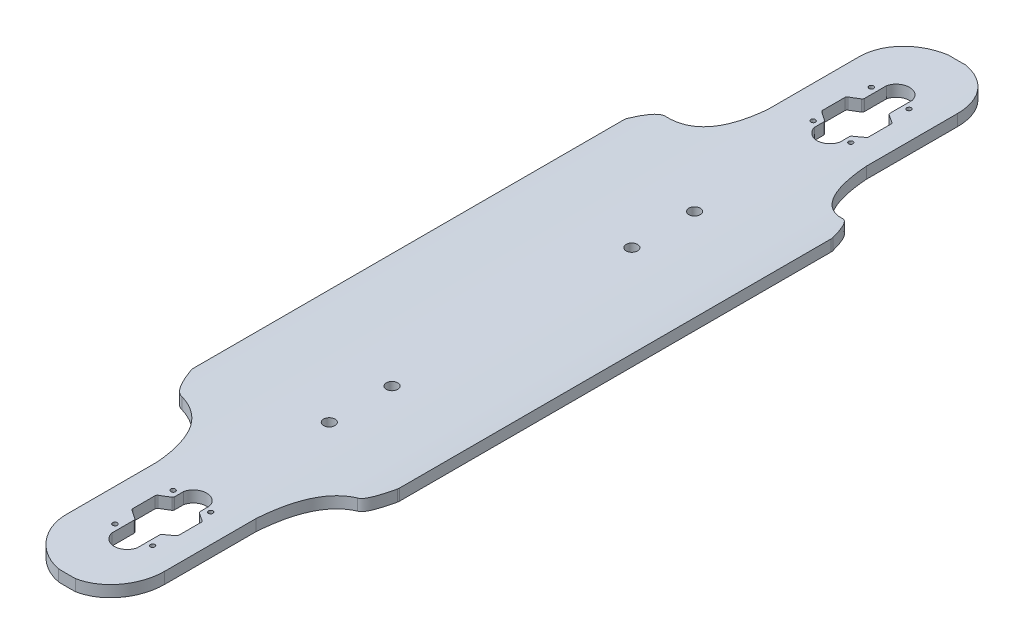
from build123d import *

# Parameters (mm, degrees)
BOSS_EXTRUDE1_DEPTH = 482.59999999999997
BOSS_EXTRUDE2_START = 98.425
BOSS_EXTRUDE2_DEPTH = 98.425
BOSS_EXTRUDE3_START = 254
BOSS_EXTRUDE3_DEPTH = 254
BOSS_EXTRUDE4_DEPTH = 254
BOSS_EXTRUDE5_DEPTH = 98.425
CUT_EXTRUDE1_DEPTH  = 98.425
SKETCH8_R           = 2.5399999999999943
SKETCH8_R_2         = 2.539999999999985
SKETCH8_R_3         = 2.5399999999999983
SKETCH8_R_4         = 2.539999999999981
SKETCH8_R_5         = 2.539999999999982
SKETCH8_R_6         = 2.539999999999969
CUT_EXTRUDE2_DEPTH  = 30.480000000000004
FILLET2_R           = 2.54
FILLET1_R           = 7.62
SKETCH9_R           = 6.349999999999994
SKETCH9_R_2         = 6.35000000000001
CUT_EXTRUDE3_DEPTH  = 38.1


with BuildPart() as part:
    # Sketch1 → Boss-Extrude1 (new body)
    with BuildSketch(Plane.XY):
        with BuildLine():
            ThreePointArc((230.18750000000014, -12.7), (115.09375000000016, -25.399999708217024), (1.3303e-13, -12.7))
            Line((1.3303e-13, -12.7), (0, 0))
            ThreePointArc((0, 0), (115.09375000000003, -12.699999708216978), (230.1875, 0))
            Line((230.1875, 0), (230.18750000000014, -12.7))
        make_face()
    extrude(amount=BOSS_EXTRUDE1_DEPTH)

    # Sketch2 → Boss-Extrude2 (add)
    with BuildSketch(Plane(origin=(0, 0, 0), x_dir=(-1, 0, 0), z_dir=(0, 0, -1)).offset(BOSS_EXTRUDE2_START)):
        with BuildLine():
            ThreePointArc((-169.86250000000015, -9.851059053133781), (-200.16770645953937, -5.799422082207116), (-230.1875, 0))
            Line((-230.1875, 0), (-230.18750000000014, -12.7))
            ThreePointArc((-230.18750000000014, -12.700000000000045), (-200.16770645953937, -18.499422082206934), (-169.86250000000013, -22.551059053133486))
            Line((-169.86250000000015, -22.551059053133592), (-169.86250000000015, -19.049999708216802))
            Line((-169.86250000000015, -19.049999708216802), (-169.86250000000015, -9.85105905313366))
        make_face()
        with BuildLine():
            ThreePointArc((0, 0), (-30.01979354046084, -5.799422082207116), (-60.32500000000019, -9.851059053133781))
            Line((-60.325000000000166, -9.85105905313366), (-60.325000000000166, -19.049999708216802))
            Line((-60.325000000000166, -19.049999708216802), (-60.325000000000166, -22.551059053133592))
            ThreePointArc((-60.32500000000017, -22.551059053133486), (-30.01979354046088, -18.499422082207047), (-5.684e-14, -12.700000000000045))
            Line((-1.3303e-13, -12.7), (0, 0))
        make_face()
    extrude(amount=-BOSS_EXTRUDE2_DEPTH)

    # Sketch3 → Boss-Extrude3 (add)
    with BuildSketch(Plane(origin=(0, 0, 0), x_dir=(-1, 0, 0), z_dir=(0, 0, -1)).offset(BOSS_EXTRUDE3_START)):
        with BuildLine():
            Line((-169.86250000000015, -9.85105905313377), (-169.86250000000015, -22.551059053133816))
            ThreePointArc((-169.86250000000015, -22.551059053133816), (-115.0937500000001, -25.399999708217024), (-60.325000000000166, -22.551059053133816))
            Line((-60.325000000000166, -22.551059053133816), (-60.325000000000166, -9.85105905313377))
            ThreePointArc((-60.325000000000166, -9.85105905313377), (-115.0937500000002, -12.699999708216978), (-169.86250000000015, -9.85105905313377))
        make_face()
    extrude(amount=-BOSS_EXTRUDE3_DEPTH)

    # Sketch4 → Boss-Extrude4 (add)
    with BuildSketch(Plane.XY.offset(482.59999999999997)):
        with BuildLine():
            ThreePointArc((169.8625, -9.851059053133667), (115.09375, -12.699999708216865), (60.32500000000002, -9.851059053133554))
            Line((60.324999999999974, -9.85105905313366), (60.32499999999996, -22.551059053133816))
            ThreePointArc((60.32499999999997, -22.55105905313377), (115.09375, -25.399999708216967), (169.86250000000004, -22.551059053133883))
            Line((169.86249999999998, -22.551059053133816), (169.86249999999998, -9.85105905313377))
        make_face()
    extrude(amount=BOSS_EXTRUDE4_DEPTH)

    # Sketch5 → Boss-Extrude5 (add)
    with BuildSketch(Plane.XY.offset(482.59999999999997)):
        with BuildLine():
            Line((0, 0), (1.3303e-13, -12.7))
            ThreePointArc((1.3303e-13, -12.7), (115.09375000000016, -25.399999708216967), (230.18750000000014, -12.7))
            Line((230.18750000000014, -12.7), (230.1875, 0))
            ThreePointArc((230.1875, 0), (115.09375000000003, -12.699999708216865), (0, 0))
        make_face()
    extrude(amount=BOSS_EXTRUDE5_DEPTH)

    # Sketch6 → Cut-Extrude1 (cut)
    with BuildSketch(Plane(origin=(0, 0, 0), x_dir=(-1, 0, 0), z_dir=(0, -1, 0))):
        with BuildLine():
            Line((-60.324999999999974, -736.5999999999999), (-60.32499999999997, -682.625))
            ThreePointArc((-60.32499999999994, -682.625), (-73.2102757559419, -717.915091552868), (-105.80314444586806, -736.6000000000001))
            Line((-105.80314444586807, -736.5999999999999), (-60.324999999999974, -736.5999999999999))
        make_face()
        with BuildLine():
            Line((-169.86249999999998, -736.5999999999999), (-124.38435555413189, -736.5999999999999))
            ThreePointArc((-124.3843555541319, -736.6000000000001), (-156.97722424405805, -717.915091552868), (-169.8625, -682.625))
            Line((-169.86249999999998, -682.625), (-169.86249999999998, -736.5999999999999))
        make_face()
        with BuildLine():
            add(Edge.make_bspline(
                [(-169.86249999999998, -581.025), (-175.13876451622016, -517.0259135470571), (-212.83209325396822, -510.9167162698411)],
                knots=[0, 0, 0, 0.8257211002132265, 0.8257211002132265, 0.8257211002132265], degree=2))
            add(Edge.make_bspline(
                [(-212.83209325396822, -510.9167162698411), (-221.5097966268928, -510.9167162698411), (-230.18749999999994, -482.5999999999999)],
                knots=[0, 0, 0, 1, 1, 1], degree=2))
            Line((-230.18749999999994, -482.5999999999999), (-230.18750000000043, -510.9167162698411))
            Line((-230.18750000000043, -510.9167162698411), (-230.1875, -581.025))
            Line((-230.1875, -581.025), (-169.86249999999998, -581.025))
        make_face()
        with BuildLine():
            add(Edge.make_bspline(
                [(-17.35540674603169, -510.9167162698411), (-8.677703373107125, -510.9167162698411), (1.398e-14, -482.5999999999999)],
                knots=[0, 0, 0, 1, 1, 1], degree=2))
            Line((1.398e-14, -482.5999999999999), (1.195e-14, -510.9167162698411))
            Line((1.195e-14, -510.9167162698411), (0, -581.025))
            Line((0, -581.025), (-60.32499999999996, -581.025))
            add(Edge.make_bspline(
                [(-60.32499999999996, -581.025), (-55.048735482398115, -517.0259135470335), (-17.35540674603169, -510.9167162698411)],
                knots=[0, 0, 0, 0.825721100213823, 0.825721100213823, 0.825721100213823], degree=2))
        make_face()
        with BuildLine():
            add(Edge.make_bspline(
                [(-60.32500000000019, 98.42499999999998), (-55.04873548239812, 34.42591354703347), (-17.355406746031782, 28.316716269841223)],
                knots=[0, 0, 0, 0.8257211002138217, 0.8257211002138217, 0.8257211002138217], degree=2))
            add(Edge.make_bspline(
                [(-17.355406746031782, 28.316716269841223), (-8.677703373107148, 28.316716269841248), (0, 0)],
                knots=[0, 0, 0, 1, 1, 1], degree=2))
            Line((0, 0), (9.714e-14, 98.425))
            Line((9.714e-14, 98.425), (-60.32500000000019, 98.42499999999998))
        make_face()
        with BuildLine():
            add(Edge.make_bspline(
                [(-212.83209325396822, 28.31671626984129), (-221.5097966268928, 28.316716269841248), (-230.18749999999994, 0)],
                knots=[0, 0, 0, 1, 1, 1], degree=2))
            Line((-230.18749999999994, 0), (-230.1875, 98.425))
            Line((-230.1875, 98.425), (-169.86250000000015, 98.425))
            add(Edge.make_bspline(
                [(-169.86250000000015, 98.425), (-175.1387645162212, 34.4259135470572), (-212.83209325396822, 28.31671626984129)],
                knots=[0, 0, 0, 0.8257211002132272, 0.8257211002132272, 0.8257211002132272], degree=2))
        make_face()
        with BuildLine():
            Line((-169.86250000000015, 254), (-169.86250000000015, 200.02499999999998))
            ThreePointArc((-169.86250000000015, 200.02499999999998), (-156.9772242440584, 235.315091552868), (-124.38435555413241, 254.00000000000023))
            Line((-124.3843555541324, 254), (-169.86250000000015, 254))
        make_face()
        with BuildLine():
            Line((-60.32500000000019, 254), (-105.80314444586791, 254))
            ThreePointArc((-105.8031444458679, 254.0000000000002), (-73.21027575594192, 235.315091552868), (-60.32500000000019, 200.02499999999998))
            Line((-60.32500000000019, 200.02499999999998), (-60.32500000000019, 254))
        make_face()
    extrude(amount=CUT_EXTRUDE1_DEPTH, mode=Mode.SUBTRACT)

    # Sketch8 → Cut-Extrude2 (cut)
    with BuildSketch(Plane(origin=(0, 0, 0), x_dir=(-1, 0, 0), z_dir=(0, -1, 0))):
        with BuildLine():
            ThreePointArc((-100.86975371724569, 109.85500081941541), (-115.09375000000001, 98.42499999999991), (-129.31774628275423, 109.8550008194154))
            Line((-129.31774628275423, 109.8550008194154), (-129.31774628275423, 121.28499999999998))
            Line((-129.31774628275423, 121.28499999999998), (-140.7477462827542, 128.90499999999997))
            Line((-140.7477462827542, 128.90499999999997), (-140.7477462827542, 156.337))
            Line((-140.7477462827542, 156.337), (-129.31774628275423, 163.95699999999997))
            Line((-129.31774628275423, 163.95699999999997), (-129.31774628275423, 189.86500081941537))
            ThreePointArc((-129.31774628275423, 189.86500081941537), (-115.09375000000001, 201.29499584735922), (-100.86975371724574, 189.86500081941537))
            Line((-100.86975371724574, 189.86500081941537), (-100.86975371724574, 163.95699999999994))
            Line((-100.86975371724574, 163.95699999999994), (-89.43975371724572, 156.33699999999996))
            Line((-89.43975371724572, 156.33699999999996), (-89.43975371724572, 128.90499999999997))
            Line((-89.43975371724572, 128.90499999999997), (-100.8697537172457, 121.28499999999998))
            Line((-100.8697537172457, 121.28499999999998), (-100.86975371724569, 109.85500081941541))
        make_face()
        with Locations(Location((-94.13875000000002, 114.93499999999999, 0), (0, 0, 270))):
            Circle(SKETCH8_R)
        with BuildLine():
            ThreePointArc((-100.86975371724569, -672.4650008194153), (-115.09374999999996, -683.8949958473592), (-129.31774628275411, -672.4650008194153))
            Line((-129.31774628275411, -672.4650008194153), (-129.31774628275411, -646.5569999999998))
            Line((-129.31774628275411, -646.5569999999998), (-140.7477462827541, -638.9369999999999))
            Line((-140.7477462827541, -638.9369999999999), (-140.7477462827541, -611.5049999999999))
            Line((-140.7477462827541, -611.5049999999999), (-129.31774628275411, -603.8849999999999))
            Line((-129.31774628275411, -603.8849999999999), (-129.31774628275411, -592.4550008194154))
            ThreePointArc((-129.31774628275411, -592.4550008194154), (-115.09374999999994, -581.0249999999999), (-100.86975371724563, -592.4550008194154))
            Line((-100.86975371724563, -592.4550008194154), (-100.86975371724564, -603.8849999999999))
            Line((-100.86975371724564, -603.8849999999999), (-89.43975371724567, -611.5049999999999))
            Line((-89.43975371724567, -611.5049999999999), (-89.43975371724567, -638.9369999999999))
            Line((-89.43975371724567, -638.9369999999999), (-100.86975371724569, -646.5569999999998))
            Line((-100.86975371724569, -646.5569999999998), (-100.86975371724569, -672.4650008194153))
        make_face()
        with Locations(Location((-136.04875, 179.70499999999998, 0), (0, 0, 270))):
            Circle(SKETCH8_R_2)
        with Locations(Location((-94.13875000000002, 179.70499999999998, 0), (0, 0, 270))):
            Circle(SKETCH8_R_3)
        with Locations(Location((-136.04875, 114.93499999999999, 0), (0, 0, 270))):
            Circle(SKETCH8_R_4)
        with Locations(Location((-94.13874999999996, -662.305, 0), (0, 0, 270))):
            Circle(SKETCH8_R_5)
        with Locations(Location((-136.0487499999999, -662.305, 0), (0, 0, 270))):
            Circle(SKETCH8_R_6)
        with Locations(Location((-94.13874999999996, -597.535, 0), (0, 0, 270))):
            Circle(SKETCH8_R_5)
        with Locations(Location((-136.0487499999999, -597.535, 0), (0, 0, 270))):
            Circle(SKETCH8_R_6)
    extrude(amount=CUT_EXTRUDE2_DEPTH, mode=Mode.SUBTRACT)

    # Fillet2
    fillet2_edges = [part.edges().sort_by_distance(p)[0] for p in [
        (100.8697537172457, -18.858324334332178, -121.28499999999998),
        (89.43975371724572, -18.426249184171922, -128.90499999999997),
        (89.43975371724572, -18.426249184171922, -156.33699999999996),
        (100.86975371724574, -18.85832433433218, -163.95699999999994),
        (129.31774628275423, -18.858324334332185, -121.28499999999998),
        (140.7477462827542, -18.426249184171933, -128.90499999999997),
        (140.7477462827542, -18.426249184171933, -156.337),
        (129.31774628275423, -18.858324334332185, -163.95699999999997),
        (140.7477462827541, -18.426249184171937, 638.9369999999999),
        (140.7477462827541, -18.426249184171937, 611.5049999999999),
        (89.43975371724567, -18.426249184171922, 638.9369999999999),
        (89.43975371724567, -18.426249184171922, 611.5049999999999),
        (129.31774628275411, -18.858324334332185, 646.5569999999998),
        (129.31774628275411, -18.858324334332185, 603.8849999999999),
        (100.86975371724569, -18.858324334332178, 646.5569999999998),
        (100.86975371724564, -18.858324334332174, 603.8849999999999),
    ]]
    fillet(fillet2_edges, radius=FILLET2_R)

    # Fillet1
    fillet1_edges = [part.edges().sort_by_distance(p)[0] for p in [
        (0, -6.350000000000027, 0),
        (-1.398e-14, -6.350000000000038, 482.5999999999999),
        (230.18749999999994, -6.350000000000027, 0),
        (230.18749999999994, -6.350000000000038, 482.5999999999999),
    ]]
    fillet(fillet1_edges, radius=FILLET1_R)

    # Sketch9 → Cut-Extrude3 (cut)
    with BuildSketch(Plane(origin=(0, 0, 0), x_dir=(-1, 0, 0), z_dir=(0, -1, 0))):
        with Locations(Location((-115.0937500000001, -444.6177007658428, 0), (0, 0, 270))):
            Circle(SKETCH9_R)
        with Locations(Location((-115.09375000000011, -374.76770076584285, 0), (0, 0, 270))):
            Circle(SKETCH9_R)
        with Locations(Location((-115.09375000000004, -107.83229923415722, 0), (0, 0, 270))):
            Circle(SKETCH9_R_2)
        with Locations(Location((-115.09375, -37.982299234157246, 0), (0, 0, 270))):
            Circle(SKETCH9_R_2)
    extrude(amount=CUT_EXTRUDE3_DEPTH, mode=Mode.SUBTRACT)


solid = part.part
